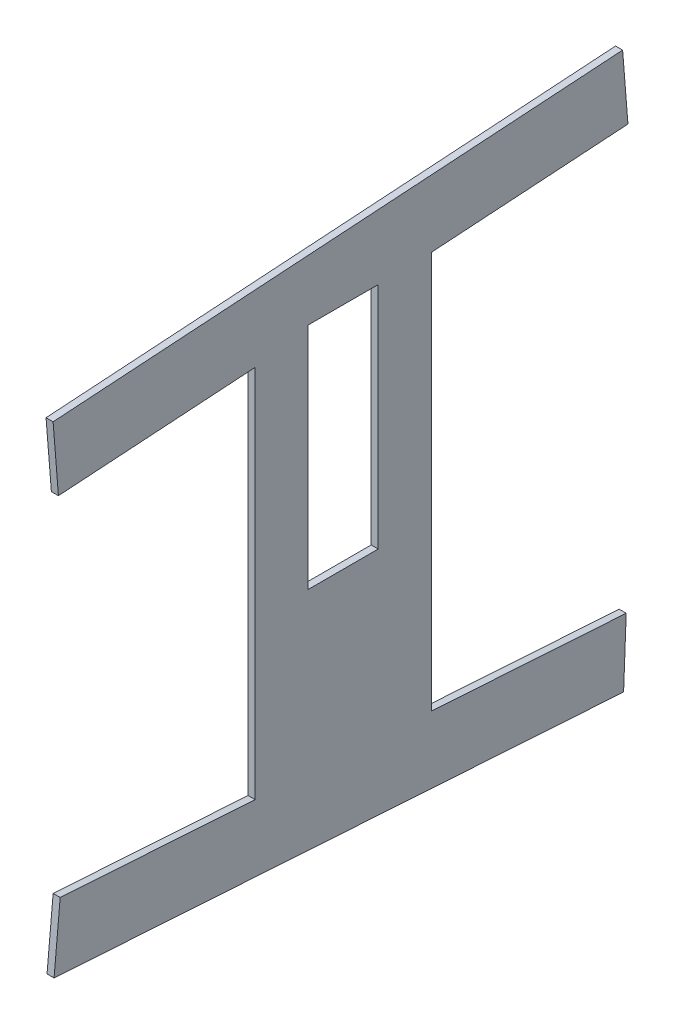
from build123d import *

# Parameters (mm, degrees)
BOSS_EXTRUDE1_DEPTH = 2
SKETCH2_W           = 20
SKETCH2_H           = 65
CUT_EXTRUDE1_DEPTH  = 115.109502301


with BuildPart() as part:
    # Sketch1 → Boss-Extrude1 (new body)
    with BuildSketch(Plane(origin=(0, 0, 0), x_dir=(0, 0, -1), z_dir=(1, 0, 0))):
        Polygon((-23.487008112, -53.123171146), (-23.487008112, 53.119179438), (-79.3154252, 49.479562724), (-80.828417088, 68.421259669), (80.828417088, 78.960138367), (82.341408976, 60.018441422), (26.512991888, 56.378824708), (26.512991888, -56.378824708), (81.84341634, -59.981558578), (81.107293536, -78.973862025), (-80.550377935, -68.447834544), (-78.817432564, -49.520437276), align=None)
    extrude(amount=BOSS_EXTRUDE1_DEPTH)

    # Sketch2 → Cut-Extrude1 (cut, through all)
    with BuildSketch(Plane(origin=(2, 0, 0), x_dir=(0, 0, -1), z_dir=(1, 0, 0))):
        with Locations((1.46172303, 23.500819189)):
            Rectangle(SKETCH2_W, SKETCH2_H)
    extrude(amount=-CUT_EXTRUDE1_DEPTH, mode=Mode.SUBTRACT)


solid = part.part
